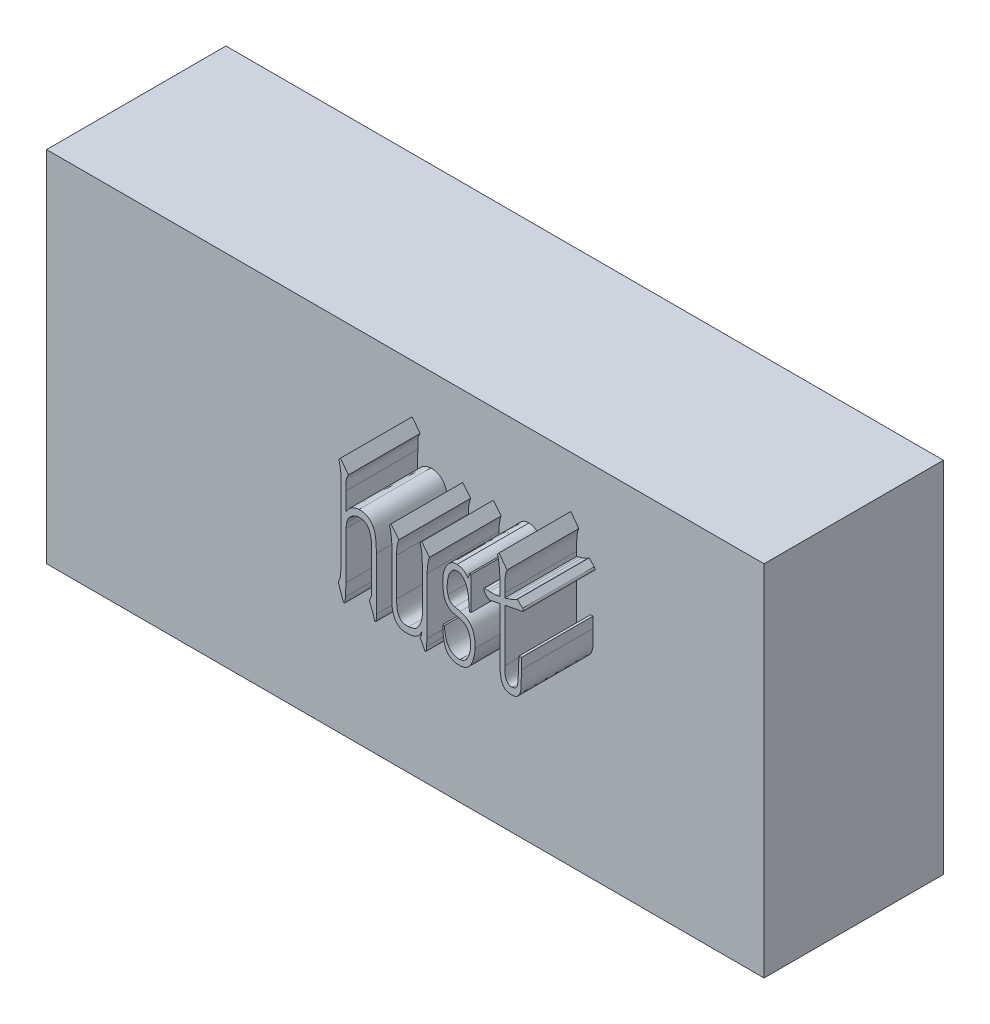
from build123d import *

# Parameters (mm, degrees)
SKETCH_1_W      = 20
SKETCH_1_H      = 10
EXTRUDE_1_DEPTH = 5
EXTRUDE_2_DEPTH = 2


with BuildPart() as part:
    # 草图1 → 凸台-拉伸1 (new body)
    with BuildSketch(Plane.XY):
        Rectangle(SKETCH_1_W, SKETCH_1_H)
    extrude(amount=EXTRUDE_1_DEPTH)

    # 草图2 → 凸台-拉伸2 (add)
    with BuildSketch(Plane.XY.offset(5)):
        with BuildLine():
            Line((0.342318346, 2.018857873), (0.347538888, 0.719688898))
            Line((0.347538888, 0.719688898), (0.327402514, 0.36245472))
            add(Edge.make_bspline(
                [(0.327402514, 0.36245472), (0.327261043, 0.33951149), (0.32700611, 0.298167565), (0.319831234, 0.250694007), (0.312686375, 0.220852894), (0.307550929, 0.207903188), (0.300514811, 0.198113872), (0.294976057, 0.20031856), (0.292350309, 0.201363733)],
                knots=[0, 0, 0, 0, 2.35043343, 4.235503956, 4.947732133, 5.450705761, 5.739596977, 6, 6, 6, 6], degree=3))
            add(Edge.make_bspline(
                [(0.292350309, 0.201363733), (0.290043838, 0.201971683), (0.283939659, 0.203580651), (0.274353479, 0.212864108), (0.262928801, 0.230660595), (0.256219407, 0.246669618), (0.252077562, 0.256552312)],
                knots=[0, 0, 0, 0, 0.400762423, 1.060635868, 2.185470958, 4, 4, 4, 4], degree=3))
            Line((0.252077562, 0.256552312), (0.231941189, 0.322181973))
            Line((0.231941189, 0.322181973), (0.171532069, 0.498188792))
            add(Edge.make_bspline(
                [(0.171532069, 0.498188792), (0.166147285, 0.51404312), (0.156611586, 0.542118916), (0.146150603, 0.579563381), (0.139768856, 0.606292862), (0.13647792, 0.630528145), (0.145770455, 0.657386566), (0.1579327, 0.690884381), (0.173750853, 0.725200845), (0.183961029, 0.760083544), (0.191259171, 0.795218598), (0.194125596, 0.836527704), (0.197853282, 0.887527656), (0.202157042, 0.936290623), (0.207390758, 0.97718023), (0.209399819, 1.004078044), (0.211036136, 1.024952465), (0.211578854, 1.036897526), (0.211804816, 1.041870872)],
                knots=[0, 0, 0, 0, 1.441064173, 2.551923013, 3.340907358, 3.813523817, 4.628196085, 5.724956108, 6.904946677, 7.866026617, 8.847838118, 9.986772895, 11.424179741, 13.250735383, 14.198144868, 14.971010842, 15.571578638, 16, 16, 16, 16], degree=3))
            Line((0.211804816, 1.041870872), (0.211804816, 3.015235457))
            add(Edge.make_bspline(
                [(0.211804816, 3.015235457), (0.21197058, 3.038854398), (0.212281213, 3.083114824), (0.210272715, 3.145001781), (0.209212715, 3.197731492), (0.206122495, 3.255198992), (0.201072926, 3.319351514), (0.189129582, 3.390991454), (0.177198368, 3.456981729), (0.169779391, 3.499002812), (0.166311528, 3.51864479)],
                knots=[0, 0, 0, 0, 1.118764017, 2.096494204, 2.932954767, 3.616902721, 4.822768865, 5.978663387, 7.05516355, 8, 8, 8, 8], degree=3))
            Line((0.166311528, 3.51864479), (0.146175154, 3.599190283))
            Line((0.146175154, 3.599190283), (0.191668442, 3.644683571))
            Line((0.191668442, 3.644683571), (0.413168549, 3.353079054))
            add(Edge.make_bspline(
                [(0.413168549, 3.353079054), (0.40399908, 3.336039378), (0.387496383, 3.305372322), (0.367453286, 3.261044754), (0.354125762, 3.218375402), (0.349263079, 3.178450922), (0.34906213, 3.135307916), (0.348119907, 3.084347862), (0.347327975, 3.01548616), (0.34746361, 2.963527514), (0.347538888, 2.934689964)],
                knots=[0, 0, 0, 0, 1.077229295, 1.938737021, 2.705029579, 3.556583808, 4.165761764, 5.107077322, 6.394400007, 8, 8, 8, 8], degree=3))
            Line((0.347538888, 2.934689964), (0.342318346, 2.42158534))
            add(Edge.make_bspline(
                [(0.342318346, 2.42158534), (0.357102581, 2.44495303), (0.384654061, 2.488500394), (0.430612727, 2.548240187), (0.486877589, 2.597393359), (0.556459385, 2.632251519), (0.631721161, 2.659018893), (0.684437784, 2.665365614), (0.709993608, 2.668442361)],
                knots=[0, 0, 0, 0, 1.07332805, 2.000223642, 2.917168891, 3.944658758, 5.003617178, 6, 6, 6, 6], degree=3))
            add(Edge.make_bspline(
                [(0.709993608, 2.668442361), (0.738423648, 2.668263751), (0.795500153, 2.667905172), (0.86573968, 2.651309622), (0.919447308, 2.629580743), (0.958632229, 2.608004855), (0.995167071, 2.579746552), (1.030156094, 2.547261733), (1.061803901, 2.509987947), (1.090824496, 2.469508719), (1.114556417, 2.424498058), (1.140908966, 2.357219859), (1.166330591, 2.262224562), (1.182297812, 2.13537654), (1.19184134, 1.995396803), (1.192780648, 1.897809376), (1.193266567, 1.847325804)],
                knots=[0, 0, 0, 0, 1.0947862, 2.19790649, 2.757337586, 3.328573185, 3.91765799, 4.535346343, 5.168052191, 5.801557691, 6.453960854, 7.125620871, 8.58724384, 10.234425199, 12.052006618, 14, 14, 14, 14], degree=3))
            Line((1.193266567, 1.847325804), (1.198487108, 0.382591093))
            add(Edge.make_bspline(
                [(1.198487108, 0.382591093), (1.19826121, 0.366937055), (1.197841577, 0.337857761), (1.196928167, 0.29717309), (1.193178846, 0.263539496), (1.187484605, 0.230025718), (1.182122281, 0.204871853), (1.167063049, 0.180373349), (1.153268976, 0.186689853), (1.146234993, 0.198088331), (1.139317866, 0.215934084), (1.130375298, 0.246908898), (1.121245503, 0.28299292), (1.11515698, 0.310983469), (1.112721074, 0.322181973)],
                knots=[0, 0, 0, 0, 1.572573266, 2.9212475, 4.076093218, 4.98698702, 6.265964789, 6.936596729, 7.205406239, 7.614753393, 8.26367014, 9.124280485, 10.849477538, 12, 12, 12, 12], degree=3))
            Line((1.112721074, 0.322181973), (1.041870872, 0.498188792))
            add(Edge.make_bspline(
                [(1.041870872, 0.498188792), (1.036179611, 0.514102977), (1.026147961, 0.542153975), (1.012770853, 0.57861357), (1.00561778, 0.604732255), (1.002563511, 0.626462284), (1.009038189, 0.647360457), (1.020313127, 0.671505184), (1.034166304, 0.7008639), (1.046796629, 0.731650122), (1.055630284, 0.767755878), (1.058690104, 0.810886458), (1.062059861, 0.868790055), (1.062026126, 0.912340121), (1.062007245, 0.936714255)],
                knots=[0, 0, 0, 0, 1.340325683, 2.362513289, 3.074752796, 3.49050492, 4.078467212, 4.766856948, 5.61340703, 6.649184137, 7.399663012, 8.548858546, 10.06846245, 12, 12, 12, 12], degree=3))
            Line((1.062007245, 0.936714255), (1.062007245, 1.822714681))
            add(Edge.make_bspline(
                [(1.062007245, 1.822714681), (1.062198137, 1.852299647), (1.062538248, 1.905010982), (1.060586267, 1.974611439), (1.059556909, 2.025349107), (1.057371367, 2.061975816), (1.052812439, 2.093566903), (1.045783946, 2.129021954), (1.037129086, 2.173204947), (1.024878727, 2.22364676), (1.00918565, 2.276525896), (0.985772633, 2.326662802), (0.955449155, 2.37155433), (0.91998594, 2.412477765), (0.87655498, 2.446261452), (0.823842013, 2.467917681), (0.763922056, 2.479351619), (0.721722164, 2.47766171), (0.699552525, 2.476773919)],
                knots=[0, 0, 0, 0, 1.654883371, 2.948494617, 3.894551186, 4.493987826, 4.999430423, 5.67857873, 6.515865899, 7.517622622, 8.581998723, 9.596035627, 10.598853585, 11.603598188, 12.616012708, 13.64406573, 14.762314118, 16, 16, 16, 16], degree=3))
            add(Edge.make_bspline(
                [(0.699552525, 2.476773919), (0.676996436, 2.473334073), (0.632620912, 2.466566723), (0.570051332, 2.443028321), (0.513611705, 2.408616073), (0.465016664, 2.365180122), (0.424651595, 2.317692936), (0.394291808, 2.269844643), (0.373984218, 2.222431489), (0.369735897, 2.190309161), (0.367675261, 2.174728319)],
                knots=[0, 0, 0, 0, 1.133360746, 2.229707407, 3.30140598, 4.406100579, 5.459715889, 6.39361091, 7.220825617, 8, 8, 8, 8], degree=3))
            Line((0.367675261, 2.174728319), (0.342318346, 2.018857873))
        make_face()
        with BuildLine():
            Line((2.411144257, 2.718410398), (2.456637545, 2.763903686))
            Line((2.456637545, 2.763903686), (2.672917111, 2.491689751))
            add(Edge.make_bspline(
                [(2.672917111, 2.491689751), (2.666897927, 2.476880592), (2.656195085, 2.450548104), (2.646519762, 2.416817894), (2.64003111, 2.38888809), (2.635083818, 2.360726643), (2.62920751, 2.323631469), (2.618813338, 2.26229054), (2.60941713, 2.177974894), (2.608001199, 2.108877444), (2.607287449, 2.074046452)],
                knots=[0, 0, 0, 0, 0.901954883, 1.603785607, 1.978329198, 2.520694973, 3.217595566, 4.099112837, 6.033621101, 8, 8, 8, 8], degree=3))
            Line((2.607287449, 2.074046452), (2.6028127, 0.493714042))
            Line((2.6028127, 0.493714042), (2.592371617, 0.296825059))
            add(Edge.make_bspline(
                [(2.592371617, 0.296825059), (2.591785861, 0.285378319), (2.590714577, 0.26444349), (2.587080027, 0.236175576), (2.5856044, 0.213986302), (2.581811397, 0.194151459), (2.576705276, 0.17817626), (2.56852032, 0.161933992), (2.55480134, 0.163741996), (2.54582064, 0.174993267), (2.534624299, 0.192573139), (2.526861776, 0.207465128), (2.522267206, 0.216279565)],
                knots=[0, 0, 0, 0, 1.638485852, 2.996610579, 4.068241337, 4.828079896, 5.839672715, 6.62244258, 6.979652832, 7.608485938, 8.584483878, 10, 10, 10, 10], degree=3))
            Line((2.522267206, 0.216279565), (2.446196463, 0.36245472))
            add(Edge.make_bspline(
                [(2.446196463, 0.36245472), (2.441008195, 0.371568592), (2.431899627, 0.387568982), (2.422660345, 0.409378255), (2.415590909, 0.425199719), (2.416148697, 0.434266836), (2.416364799, 0.437779672)],
                knots=[0, 0, 0, 0, 1.529770544, 2.685677999, 3.490797633, 4, 4, 4, 4], degree=3))
            Line((2.416364799, 0.437779672), (2.441721713, 0.48327296))
            Line((2.441721713, 0.48327296), (2.461858087, 0.589175368))
            add(Edge.make_bspline(
                [(2.461858087, 0.589175368), (2.451624875, 0.569911613), (2.432004878, 0.532977479), (2.404719953, 0.488659865), (2.379135564, 0.45513354), (2.350864648, 0.433646228), (2.318588364, 0.409964319), (2.278961534, 0.388763769), (2.23373886, 0.36995589), (2.182119538, 0.356380862), (2.124696587, 0.349534962), (2.08450327, 0.348221699), (2.06360537, 0.347538888)],
                knots=[0, 0, 0, 0, 1.312029654, 2.515536564, 3.132302309, 3.833292519, 4.638429977, 5.542167297, 6.528311998, 7.580541878, 8.742039772, 10, 10, 10, 10], degree=3))
            add(Edge.make_bspline(
                [(2.06360537, 0.347538888), (2.039705588, 0.347387207), (1.99415705, 0.347098133), (1.929310036, 0.35683285), (1.871627123, 0.374410494), (1.82168934, 0.401083366), (1.778588671, 0.434389683), (1.741654925, 0.473872061), (1.71013801, 0.518768429), (1.676707591, 0.586220761), (1.647137217, 0.677701691), (1.632941438, 0.775927949), (1.630162185, 0.862372578), (1.627751599, 0.939931821), (1.626369179, 1.029685469), (1.626014668, 1.093578814), (1.625825698, 1.127636906)],
                knots=[0, 0, 0, 0, 0.968661519, 1.846088638, 2.650099344, 3.403737013, 4.130145597, 4.850928472, 5.589769445, 6.347715959, 7.898125862, 9.468914246, 10.35757796, 11.407170027, 12.617902367, 14, 14, 14, 14], degree=3))
            Line((1.625825698, 1.127636906), (1.625825698, 2.174728319))
            add(Edge.make_bspline(
                [(1.625825698, 2.174728319), (1.625712622, 2.208798516), (1.625495352, 2.274263098), (1.619042711, 2.368528418), (1.610421982, 2.454615867), (1.599193379, 2.53033631), (1.588814802, 2.592127762), (1.582815387, 2.628169047), (1.58033241, 2.643085446)],
                knots=[0, 0, 0, 0, 1.300902488, 2.499634388, 3.606888644, 4.604547608, 5.422464392, 6, 6, 6, 6], degree=3))
            Line((1.58033241, 2.643085446), (1.555721287, 2.718410398))
            Line((1.555721287, 2.718410398), (1.600468783, 2.763903686))
            Line((1.600468783, 2.763903686), (1.82196889, 2.491689751))
            add(Edge.make_bspline(
                [(1.82196889, 2.491689751), (1.815822323, 2.476346533), (1.804529846, 2.448157963), (1.790286803, 2.404686971), (1.779297776, 2.354443766), (1.769696417, 2.303747214), (1.763195594, 2.251652424), (1.759612299, 2.202624281), (1.757448558, 2.14615934), (1.757211058, 2.105869066), (1.75708502, 2.084487535)],
                knots=[0, 0, 0, 0, 0.955062306, 1.754641118, 2.639723451, 3.924612311, 4.735340528, 5.671856169, 6.764483984, 8, 8, 8, 8], degree=3))
            Line((1.75708502, 2.084487535), (1.75708502, 1.026955039))
            add(Edge.make_bspline(
                [(1.75708502, 1.026955039), (1.757258395, 0.993114723), (1.757584083, 0.929545126), (1.76652495, 0.840997868), (1.776953837, 0.764966918), (1.795192102, 0.701977268), (1.817508558, 0.649699395), (1.845080305, 0.607543044), (1.87723893, 0.573925518), (1.91439306, 0.549892534), (1.95559012, 0.533834923), (1.999663286, 0.526692502), (2.046280296, 0.522607318), (2.077791454, 0.526658774), (2.094182825, 0.528766248)],
                knots=[0, 0, 0, 0, 1.7189745, 3.229122124, 4.521318276, 5.613109994, 6.552296241, 7.4004455, 8.159999876, 8.899528822, 9.631679654, 10.390076894, 11.16255546, 12, 12, 12, 12], degree=3))
            add(Edge.make_bspline(
                [(2.094182825, 0.528766248), (2.119931912, 0.532312476), (2.167534612, 0.53886844), (2.231412815, 0.557600142), (2.283340375, 0.580406604), (2.332769518, 0.622014292), (2.377472454, 0.684265281), (2.419687429, 0.763317502), (2.45071226, 0.842713306), (2.46567481, 0.909087919), (2.47116815, 0.96325686), (2.475276504, 1.010718505), (2.476106242, 1.066482619), (2.476540524, 1.106259678), (2.476773919, 1.127636906)],
                knots=[0, 0, 0, 0, 1.171183412, 2.165183308, 2.998184278, 3.707820518, 5.051940327, 6.427255088, 7.748233698, 8.886001551, 9.484403013, 10.204602517, 11.035106635, 12, 12, 12, 12], degree=3))
            Line((2.476773919, 1.127636906), (2.476773919, 2.094182825))
            add(Edge.make_bspline(
                [(2.476773919, 2.094182825), (2.476621438, 2.137695071), (2.47631807, 2.224265433), (2.470921613, 2.33040375), (2.465762259, 2.409660124), (2.462622399, 2.459218735), (2.457746217, 2.498914141), (2.452898795, 2.539807389), (2.444984255, 2.587019898), (2.436006793, 2.62374933), (2.431280631, 2.643085446)],
                knots=[0, 0, 0, 0, 1.89138301, 3.763026071, 4.618502937, 5.344598615, 5.921038749, 6.356690794, 7.134884036, 8, 8, 8, 8], degree=3))
            Line((2.431280631, 2.643085446), (2.411144257, 2.718410398))
        make_face()
        with BuildLine():
            Line((3.752077562, 2.522267206), (3.79757085, 2.66322182))
            Line((3.79757085, 2.66322182), (3.832623056, 2.658001278))
            Line((3.832623056, 2.658001278), (3.832623056, 1.736948647))
            Line((3.832623056, 1.736948647), (3.787875559, 1.736948647))
            add(Edge.make_bspline(
                [(3.787875559, 1.736948647), (3.784396534, 1.78667141), (3.777767295, 1.88141751), (3.768125182, 2.018869804), (3.753395902, 2.149812964), (3.726779941, 2.254181503), (3.700291185, 2.334352191), (3.673575593, 2.387599138), (3.643603817, 2.435317015), (3.607432461, 2.474416059), (3.569889024, 2.506759772), (3.530993062, 2.530385766), (3.490821948, 2.545040791), (3.4635709, 2.546766667), (3.450031962, 2.547624121)],
                knots=[0, 0, 0, 0, 1.88437823, 3.590658997, 5.211116296, 6.856969368, 7.653605172, 8.397603321, 9.104084967, 9.776155038, 10.403139336, 10.972141148, 11.489336478, 12, 12, 12, 12], degree=3))
            add(Edge.make_bspline(
                [(3.450031962, 2.547624121), (3.432417318, 2.546064854), (3.398149615, 2.543031442), (3.350819777, 2.522888982), (3.308452664, 2.494562309), (3.264165432, 2.441415007), (3.221349766, 2.367309418), (3.190718825, 2.269609155), (3.175005716, 2.166710361), (3.166288132, 2.077485446), (3.163260383, 2.003876017), (3.167595446, 1.950568202), (3.174146723, 1.899849842), (3.183614036, 1.868116229), (3.188259109, 1.852546346)],
                knots=[0, 0, 0, 0, 0.763111865, 1.484565427, 2.206018988, 2.955268939, 4.4638776, 5.893852316, 7.371769709, 8.976120531, 9.785810629, 10.56470826, 11.295783766, 12, 12, 12, 12], degree=3))
            add(Edge.make_bspline(
                [(3.188259109, 1.852546346), (3.191537355, 1.838228755), (3.19775923, 1.811054994), (3.213553122, 1.774634166), (3.229157817, 1.742373396), (3.250096257, 1.716030702), (3.275581719, 1.694934312), (3.305332023, 1.676585851), (3.340628714, 1.661860762), (3.366408502, 1.654855964), (3.379927552, 1.651182612)],
                knots=[0, 0, 0, 0, 1.181279318, 2.241983418, 3.192228972, 4.062377461, 4.929751825, 5.847528273, 6.871233056, 8, 8, 8, 8], degree=3))
            Line((3.379927552, 1.651182612), (3.530577456, 1.616130407))
            add(Edge.make_bspline(
                [(3.530577456, 1.616130407), (3.564072187, 1.605241264), (3.627986122, 1.584462833), (3.714055337, 1.537683246), (3.788449818, 1.481057201), (3.835897917, 1.419480231), (3.867323166, 1.364044564), (3.889403164, 1.316604569), (3.907329877, 1.262864891), (3.929751399, 1.183269576), (3.948558636, 1.073775128), (3.948827201, 0.983535306), (3.948966546, 0.936714255)],
                knots=[0, 0, 0, 0, 1.209249621, 2.307464452, 3.354609308, 4.401754164, 4.953353382, 5.546482869, 6.198302843, 6.899633981, 8.39137101, 10, 10, 10, 10], degree=3))
            add(Edge.make_bspline(
                [(3.948966546, 0.936714255), (3.944432482, 0.888061495), (3.935630292, 0.793609617), (3.908493767, 0.68051691), (3.882262435, 0.598297277), (3.861707359, 0.544202137), (3.838558782, 0.497110111), (3.80665544, 0.444372071), (3.760447514, 0.389187156), (3.704140348, 0.347625724), (3.654244214, 0.32277661), (3.611553196, 0.311805808), (3.565268626, 0.302671932), (3.532620681, 0.302259723), (3.515661624, 0.3020456)],
                knots=[0, 0, 0, 0, 2.057181033, 3.993701746, 4.884987729, 5.694367223, 6.430000302, 7.093039265, 8.289669114, 9.435885792, 10.016959139, 10.627150019, 11.286869617, 12, 12, 12, 12], degree=3))
            add(Edge.make_bspline(
                [(3.515661624, 0.3020456), (3.498487684, 0.301584906), (3.464519144, 0.300673695), (3.414845937, 0.307295287), (3.366851807, 0.317317929), (3.308986025, 0.338767014), (3.246365514, 0.372213181), (3.183635819, 0.422031547), (3.139857145, 0.486815326), (3.108167666, 0.56248449), (3.084866004, 0.647578419), (3.066398213, 0.736733625), (3.055001501, 0.825302718), (3.053327119, 0.883485792), (3.052525037, 0.911357341)],
                knots=[0, 0, 0, 0, 0.705919631, 1.396246844, 2.056504843, 2.719925773, 3.928363854, 4.96712199, 5.980428126, 7.107526555, 8.331541373, 9.605625387, 10.853018187, 12, 12, 12, 12], degree=3))
            Line((3.052525037, 0.911357341), (3.047304496, 1.057532495))
            Line((3.047304496, 1.057532495), (3.092797784, 1.057532495))
            add(Edge.make_bspline(
                [(3.092797784, 1.057532495), (3.093331017, 1.033664123), (3.094332219, 0.988848759), (3.099172137, 0.922142153), (3.112233671, 0.852834813), (3.12913113, 0.774480074), (3.159203735, 0.689048051), (3.195950681, 0.618781617), (3.234309217, 0.56673039), (3.268818646, 0.532423684), (3.308079236, 0.502753967), (3.351812198, 0.479590488), (3.396953783, 0.461320882), (3.442646284, 0.452164927), (3.487149536, 0.447057534), (3.516175741, 0.451324291), (3.530577456, 0.453441296)],
                knots=[0, 0, 0, 0, 1.180171397, 2.215895155, 3.300676226, 4.66281128, 6.174567634, 7.763264609, 8.561949105, 9.36129496, 10.159979456, 10.984704713, 11.801612493, 12.555966091, 13.283524481, 14, 14, 14, 14], degree=3))
            add(Edge.make_bspline(
                [(3.530577456, 0.453441296), (3.54434182, 0.455525007), (3.570798092, 0.459530077), (3.607888299, 0.47186835), (3.641339572, 0.487951458), (3.670511621, 0.510710077), (3.697260808, 0.539045119), (3.721450439, 0.574707955), (3.74545687, 0.616811394), (3.767999175, 0.665146799), (3.788243716, 0.718273751), (3.803078195, 0.77475025), (3.812024457, 0.83351122), (3.81516321, 0.892671603), (3.815519403, 0.949143998), (3.815519919, 1.000103485), (3.815279433, 1.043653946), (3.813352128, 1.070216045), (3.812486682, 1.082143618)],
                knots=[0, 0, 0, 0, 0.877851347, 1.68730455, 2.459813735, 3.21046647, 4.01026565, 4.912088624, 5.924932797, 7.069995579, 8.277531082, 9.51162898, 10.750911348, 12.025314486, 13.250286763, 14.318123558, 15.244762084, 16, 16, 16, 16], degree=3))
            add(Edge.make_bspline(
                [(3.812486682, 1.082143618), (3.805557832, 1.112218546), (3.792451785, 1.169105826), (3.762190356, 1.245666982), (3.728986738, 1.310362912), (3.683861577, 1.357723705), (3.63298919, 1.39300016), (3.573213329, 1.419417522), (3.501838493, 1.441995512), (3.418797076, 1.459911254), (3.332575931, 1.482511845), (3.263730616, 1.509072439), (3.21553464, 1.53933113), (3.183283777, 1.568429651), (3.153050075, 1.602949654), (3.126630972, 1.644064819), (3.103436258, 1.690259807), (3.085186035, 1.741245278), (3.06998855, 1.796306022), (3.055853528, 1.874663759), (3.046079056, 1.972866439), (3.043887875, 2.051155995), (3.042829746, 2.088962284)],
                knots=[0, 0, 0, 0, 1.312732654, 2.483057945, 3.5025627, 4.386828712, 5.238919358, 6.125149634, 7.160161885, 8.424087566, 9.742278237, 10.957883032, 11.548460543, 12.15626294, 12.801923705, 13.498163234, 14.232361306, 14.99973133, 15.801420386, 16.663524038, 18.388804572, 20, 20, 20, 20], degree=3))
            add(Edge.make_bspline(
                [(3.042829746, 2.088962284), (3.043126481, 2.110842662), (3.043700386, 2.153160804), (3.047780993, 2.214259605), (3.056421438, 2.27041662), (3.069753084, 2.33919296), (3.096485448, 2.419199492), (3.135375007, 2.509872653), (3.187605712, 2.5910804), (3.2455387, 2.645522379), (3.298699975, 2.678767517), (3.34401972, 2.696051638), (3.393367213, 2.706544999), (3.427853163, 2.707978957), (3.445557213, 2.708715108)],
                knots=[0, 0, 0, 0, 0.958068417, 1.852969566, 2.678027658, 3.444349453, 4.917639168, 6.359843754, 7.757537576, 9.112888036, 9.801703641, 10.490949085, 11.225298654, 12, 12, 12, 12], degree=3))
            add(Edge.make_bspline(
                [(3.445557213, 2.708715108), (3.474509502, 2.705391618), (3.531321555, 2.698870053), (3.606518288, 2.666437031), (3.667806614, 2.629585778), (3.695475875, 2.596745786), (3.707330066, 2.582676326)],
                knots=[0, 0, 0, 0, 1.164144761, 2.284360071, 3.264977708, 4, 4, 4, 4], degree=3))
            Line((3.707330066, 2.582676326), (3.752077562, 2.522267206))
        make_face()
        with BuildLine():
            add(Edge.make_bspline(
                [(4.774557852, 2.562539953), (4.779034316, 2.562691212), (4.786531597, 2.562944543), (4.799352906, 2.564782094), (4.816254759, 2.573045589), (4.830699567, 2.578858299), (4.840187513, 2.582676326)],
                knots=[0, 0, 0, 0, 0.775679319, 1.299124722, 2.225953526, 4, 4, 4, 4], degree=3))
            Line((4.840187513, 2.582676326), (4.935648839, 2.612507991))
            add(Edge.make_bspline(
                [(4.935648839, 2.612507991), (4.948138796, 2.616318274), (4.974413444, 2.624333822), (5.012586576, 2.639671349), (5.047831257, 2.654763772), (5.06801058, 2.667495581), (5.076603452, 2.672917111)],
                knots=[0, 0, 0, 0, 1.017936952, 2.141395217, 3.208558587, 4, 4, 4, 4], degree=3))
            Line((5.076603452, 2.672917111), (5.12209674, 2.703494566))
            Line((5.12209674, 2.703494566), (5.267526103, 2.562539953))
            add(Edge.make_bspline(
                [(5.267526103, 2.562539953), (5.273064597, 2.555162934), (5.282790569, 2.542208389), (5.28873548, 2.520994769), (5.2867888, 2.503663132), (5.281447761, 2.488413418), (5.26533461, 2.476546767), (5.251395055, 2.476688), (5.24291498, 2.476773919)],
                knots=[0, 0, 0, 0, 1.373674801, 2.412266071, 3.197745606, 3.965371001, 4.762241242, 6, 6, 6, 6], degree=3))
            Line((5.24291498, 2.476773919), (5.166844236, 2.467078628))
            add(Edge.make_bspline(
                [(5.166844236, 2.467078628), (5.144467166, 2.463124374), (5.097172573, 2.454766943), (5.021857094, 2.440947656), (4.938872969, 2.421604389), (4.880466722, 2.408375932), (4.849882804, 2.401448967)],
                knots=[0, 0, 0, 0, 0.842298951, 1.780223452, 2.837633525, 4, 4, 4, 4], degree=3))
            Line((4.849882804, 2.401448967), (4.774557852, 2.386533134))
            Line((4.774557852, 2.386533134), (4.774557852, 0.926273173))
            add(Edge.make_bspline(
                [(4.774557852, 0.926273173), (4.775073445, 0.89047561), (4.776001469, 0.826043016), (4.780228795, 0.739987502), (4.789172125, 0.675520825), (4.804298034, 0.619337733), (4.834839414, 0.573173858), (4.868440727, 0.53747528), (4.900519721, 0.519046006), (4.928158742, 0.513360752), (4.958515609, 0.50947425), (4.97965268, 0.512336074), (4.990837417, 0.513850416)],
                knots=[0, 0, 0, 0, 1.99062612, 3.582959082, 4.785050357, 5.607126213, 6.792334806, 7.818522908, 8.307161749, 8.820023072, 9.375612096, 10, 10, 10, 10], degree=3))
            add(Edge.make_bspline(
                [(4.990837417, 0.513850416), (5.002129791, 0.515104027), (5.023463761, 0.517472396), (5.052853503, 0.528496111), (5.078005925, 0.543988651), (5.098595147, 0.566369915), (5.114248096, 0.596183249), (5.126679846, 0.633935757), (5.135200473, 0.680340731), (5.139791604, 0.735530357), (5.143022141, 0.800244767), (5.147847458, 0.875040502), (5.152001258, 0.960340455), (5.155368063, 1.020493708), (5.157148945, 1.052311954)],
                knots=[0, 0, 0, 0, 0.661816756, 1.250328735, 1.818761493, 2.374038654, 3.004980104, 3.772443445, 4.690165054, 5.755886687, 7.007772156, 8.478118799, 10.137090273, 12, 12, 12, 12], degree=3))
            Line((5.157148945, 1.052311954), (5.166844236, 1.354357554))
            Line((5.166844236, 1.354357554), (5.232473897, 1.354357554))
            Line((5.232473897, 1.354357554), (5.232473897, 1.057532495))
            add(Edge.make_bspline(
                [(5.232473897, 1.057532495), (5.232466927, 1.018502456), (5.232454096, 0.946657351), (5.232533805, 0.847967451), (5.232310685, 0.767661629), (5.233056416, 0.6858301), (5.228630238, 0.597095217), (5.210843962, 0.515000393), (5.191144677, 0.454068385), (5.16961954, 0.4157569), (5.144987918, 0.382544516), (5.114838, 0.356420437), (5.080709923, 0.336443587), (5.042268853, 0.324108505), (5.000370137, 0.316090839), (4.970989302, 0.316664548), (4.955785212, 0.316961432)],
                knots=[0, 0, 0, 0, 1.824051209, 3.357648404, 4.612409746, 5.576717073, 7.183429291, 8.751149283, 9.48970251, 10.165655838, 10.795398724, 11.412912429, 12.016721546, 12.630288034, 13.291196981, 14, 14, 14, 14], degree=3))
            add(Edge.make_bspline(
                [(4.955785212, 0.316961432), (4.936587601, 0.31759254), (4.900308034, 0.318785206), (4.84884692, 0.329959445), (4.804448111, 0.349574245), (4.765636047, 0.376176751), (4.733678396, 0.412017372), (4.706979756, 0.455897913), (4.684821663, 0.507957424), (4.666735951, 0.568183372), (4.65511884, 0.637382874), (4.645031036, 0.714456506), (4.640411265, 0.800182083), (4.639370019, 0.859895319), (4.63882378, 0.891220967)],
                knots=[0, 0, 0, 0, 0.926630348, 1.751142183, 2.52541162, 3.258346252, 4.006374447, 4.826150188, 5.72969289, 6.732703069, 7.856222451, 9.114864205, 10.486453688, 12, 12, 12, 12], degree=3))
            Line((4.63882378, 0.891220967), (4.633603239, 2.355955679))
            Line((4.633603239, 2.355955679), (4.34125293, 2.295546559))
            add(Edge.make_bspline(
                [(4.34125293, 2.295546559), (4.325535088, 2.308405498), (4.295643905, 2.332859803), (4.253932618, 2.368747876), (4.219979245, 2.405917085), (4.200248731, 2.445847985), (4.191432434, 2.476866025), (4.187698861, 2.500171215), (4.198391407, 2.511731742), (4.206348332, 2.515156627), (4.210739399, 2.517046665)],
                knots=[0, 0, 0, 0, 1.677073101, 3.189350026, 4.543248612, 5.810307843, 6.791681809, 7.284404625, 7.605095309, 8, 8, 8, 8], degree=3))
            Line((4.210739399, 2.517046665), (4.286064351, 2.507351374))
            Line((4.286064351, 2.507351374), (4.356914554, 2.507351374))
            add(Edge.make_bspline(
                [(4.356914554, 2.507351374), (4.376070687, 2.507292585), (4.412158952, 2.507181831), (4.462466561, 2.504197774), (4.505762508, 2.503154136), (4.531233464, 2.509147594), (4.542616663, 2.511826124)],
                knots=[0, 0, 0, 0, 1.23233348, 2.321594721, 3.24990559, 4, 4, 4, 4], degree=3))
            Line((4.542616663, 2.511826124), (4.63882378, 2.531962497))
            Line((4.63882378, 2.531962497), (4.63882378, 2.919774132))
            add(Edge.make_bspline(
                [(4.63882378, 2.919774132), (4.638423006, 2.957820629), (4.637670669, 3.029241812), (4.631378104, 3.131220489), (4.622353584, 3.224968318), (4.612229682, 3.298850321), (4.60598255, 3.353678075), (4.600086491, 3.387568551), (4.596706796, 3.415000026), (4.594347439, 3.431141765), (4.593330492, 3.438099297)],
                knots=[0, 0, 0, 0, 1.752936068, 3.290625287, 4.706267004, 6.091551946, 6.726653401, 7.248323029, 7.676006595, 8, 8, 8, 8], degree=3))
            Line((4.593330492, 3.438099297), (4.567973578, 3.51864479))
            Line((4.567973578, 3.51864479), (4.613466866, 3.569358619))
            Line((4.613466866, 3.569358619), (4.834966972, 3.267313019))
            add(Edge.make_bspline(
                [(4.834966972, 3.267313019), (4.828851691, 3.25046355), (4.817692194, 3.219715724), (4.803508668, 3.173815127), (4.793815284, 3.124742388), (4.785494938, 3.083569121), (4.781657685, 3.047585533), (4.779363752, 3.019500239), (4.778272834, 2.983662747), (4.776441931, 2.939926101), (4.776088368, 2.888200256), (4.775269609, 2.828540137), (4.774344588, 2.761171438), (4.774484087, 2.713687377), (4.774557852, 2.688578734)],
                knots=[0, 0, 0, 0, 1.101499709, 2.010076481, 2.94784529, 4.173376765, 4.588341219, 5.170599297, 5.904438007, 6.790917629, 7.860280415, 9.08238009, 10.457219685, 12, 12, 12, 12], degree=3))
            Line((4.774557852, 2.688578734), (4.774557852, 2.562539953))
        make_face()
    extrude(amount=EXTRUDE_2_DEPTH)


solid = part.part
